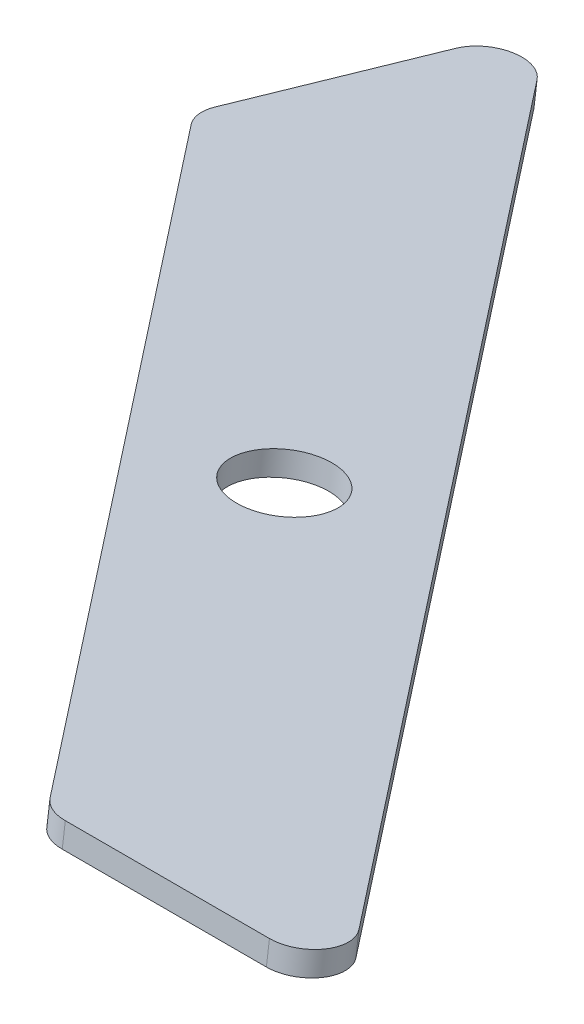
from build123d import *

# Parameters (mm, degrees)
SKETCH1_R           = 3.2639
BOSS_EXTRUDE1_DEPTH = 1.5875
FILLET1_R           = 2.54


with BuildPart() as part:
    # Sketch1 → Boss-Extrude1 (new body)
    with BuildSketch(Plane(origin=(0, -785.861825839, 104.292078675), x_dir=(-1, 0, 0), z_dir=(9.944750197447412e-14, -0.9913086058858306, 0.13155701386353877))):
        Polygon((-211.341681675, -566.749998262), (-254.480094353, -620.289871881), (-274.866911981, -620.289871881), (-215.678254388, -546.829745501), align=None)
        with Locations((-239.091735599, -588.539871881)):
            Circle(SKETCH1_R, mode=Mode.SUBTRACT)
    extrude(amount=BOSS_EXTRUDE1_DEPTH)

    # Fillet1
    fillet1_edges = [part.edges().sort_by_distance(p)[0] for p in [
        (274.866911981, -705.04519377, 719.295190195),
        (254.480094353, -705.04519377, 719.295190195),
        (211.341681675, -712.088739666, 666.220652718),
        (215.678254388, -714.709388635, 646.473534724),
    ]]
    fillet(fillet1_edges, radius=FILLET1_R)


solid = part.part
